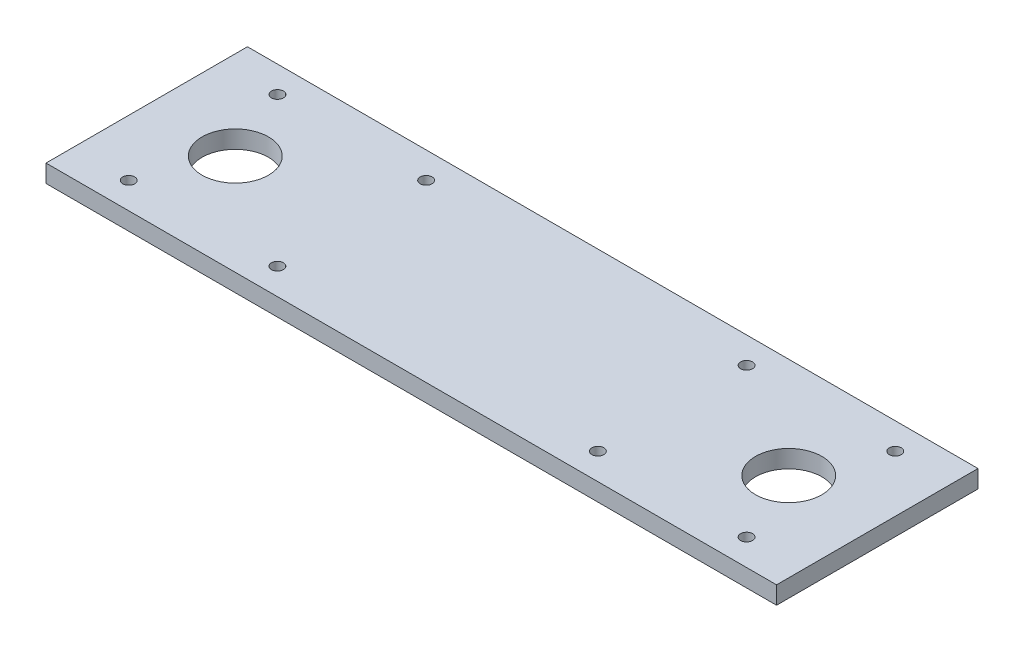
from build123d import *

# Parameters (mm, degrees)
SKETCH1_W           = 330
SKETCH1_H           = 91
BOSS_EXTRUDE2_DEPTH = 8
SKETCH4_R           = 15
SKETCH4_R_2         = 2.7
CUT_EXTRUDE4_DEPTH  = 8


with BuildPart() as part:
    # Sketch1 → Boss-Extrude2 (new body)
    with BuildSketch(Plane(origin=(0, 0, 0), x_dir=(1, 0, 0), z_dir=(0, 1, 0))):
        Rectangle(SKETCH1_W, SKETCH1_H)
    extrude(amount=BOSS_EXTRUDE2_DEPTH)

    # Sketch4 → Cut-Extrude4 (cut)
    with BuildSketch(Plane(origin=(0, 8, 0), x_dir=(1, 0, 0), z_dir=(0, 1, 0))):
        with Locations(Location((125, 0, 0), (0, 0, 270))):
            Circle(SKETCH4_R)
        with Locations(Location((-125, 0, 0), (0, 0, 270))):
            Circle(SKETCH4_R)
        with Locations(Location((-139.55, 33.59, 0), (0, 0, 270))):
            Circle(SKETCH4_R_2)
        with Locations(Location((-139.55, -33.59, 0), (0, 0, 270))):
            Circle(SKETCH4_R_2)
        with Locations(Location((-72.37, -33.59, 0), (0, 0, 270))):
            Circle(SKETCH4_R_2)
        with Locations(Location((-72.37, 33.59, 0), (0, 0, 270))):
            Circle(SKETCH4_R_2)
        with Locations(Location((139.55, -33.59, 0), (0, 0, 90))):
            Circle(SKETCH4_R_2)
        with Locations(Location((72.37, -33.59, 0), (0, 0, 90))):
            Circle(SKETCH4_R_2)
        with Locations(Location((72.37, 33.59, 0), (0, 0, 90))):
            Circle(SKETCH4_R_2)
        with Locations(Location((139.55, 33.59, 0), (0, 0, 90))):
            Circle(SKETCH4_R_2)
    extrude(amount=-CUT_EXTRUDE4_DEPTH, mode=Mode.SUBTRACT)


solid = part.part
